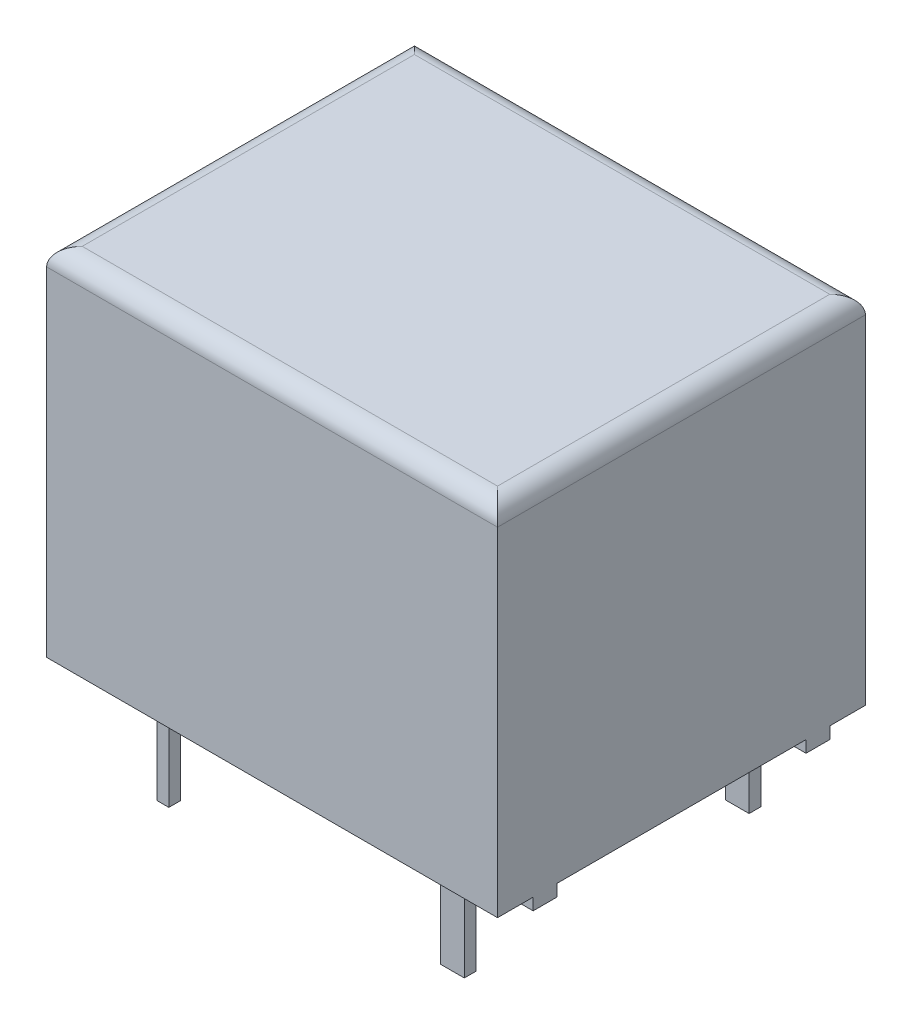
from build123d import *

# Parameters (mm, degrees)
SKETCH1_W                         = 19
SKETCH1_H                         = 15.5
BASE_EXTRUSION_DEPTH              = 15
SKETCH2_W                         = 0.3
SKETCH2_H                         = 1.2
SKETCH2_W_2                       = 0.5
SKETCH2_H_2                       = 0.5
SKETCH2_W_3                       = 1
PINS_DEPTH                        = 4.4
SKETCH3_W                         = 0.5
SKETCH3_H                         = 1
STANDOFF_DEPTH                    = 0.5
STANDOFF_MIRROR_2_COPY_1_SKETCH_W = 0.5
STANDOFF_MIRROR_2_COPY_1_SKETCH_H = 1
STANDOFF_MIRROR_2_COPY_1_DEPTH    = 0.5
TOP_EDGE_ROUNDS_R                 = 0.75


with BuildPart() as part:
    # Sketch1 → Base Extrusion (new body)
    with BuildSketch(Plane(origin=(0, 0, 0), x_dir=(1, 0, 0), z_dir=(0, 1, 0))):
        Rectangle(SKETCH1_W, SKETCH1_H)
    extrude(amount=BASE_EXTRUSION_DEPTH)

    # Sketch2 → Pins (add)
    with BuildSketch(Plane.XZ):
        with Locations((-8.1, 0)):
            Rectangle(SKETCH2_W, SKETCH2_H)
        with Locations((-6.1, -6)):
            Rectangle(SKETCH2_W_2, SKETCH2_H_2)
        with Locations((-6.1, 6)):
            Rectangle(SKETCH2_W_2, SKETCH2_H_2)
        with Locations((6.1, 6)):
            Rectangle(SKETCH2_W_3, SKETCH2_H_2)
        with Locations((6.1, -6)):
            Rectangle(SKETCH2_W_3, SKETCH2_H_2)
    extrude(amount=PINS_DEPTH)

    # Sketch3 → Standoff (add)
    with BuildSketch(Plane.XZ):
        with Locations((-9.25, 5.75)):
            Rectangle(SKETCH3_W, SKETCH3_H)
    standoff = extrude(amount=STANDOFF_DEPTH)

    # Standoff Mirror: Standoff across plane
    add(standoff.mirror(Plane.XY))

    # Standoff Mirror 2: Standoff across plane
    add(standoff.mirror(Plane(origin=(0, 0, 0), x_dir=(0, 0, 1), z_dir=(1, 0, 0))))

    # Standoff Mirror 2 copy 1 sketch → Standoff Mirror 2 copy 1 (add)
    with BuildSketch(Plane(origin=(0, 0, 0), x_dir=(-1, 0, 0), z_dir=(0, -1, 0))):
        with Locations((-9.25, 5.75)):
            Rectangle(STANDOFF_MIRROR_2_COPY_1_SKETCH_W, STANDOFF_MIRROR_2_COPY_1_SKETCH_H)
    extrude(amount=STANDOFF_MIRROR_2_COPY_1_DEPTH)

    # Top Edge Rounds
    top_edge_rounds_edges = [part.edges().sort_by_distance(p)[0] for p in [
        (9.5, 15, 0),
        (0, 15, -7.75),
        (-9.5, 15, 0),
        (0, 15, 7.75),
    ]]
    fillet(top_edge_rounds_edges, radius=TOP_EDGE_ROUNDS_R)


solid = part.part
